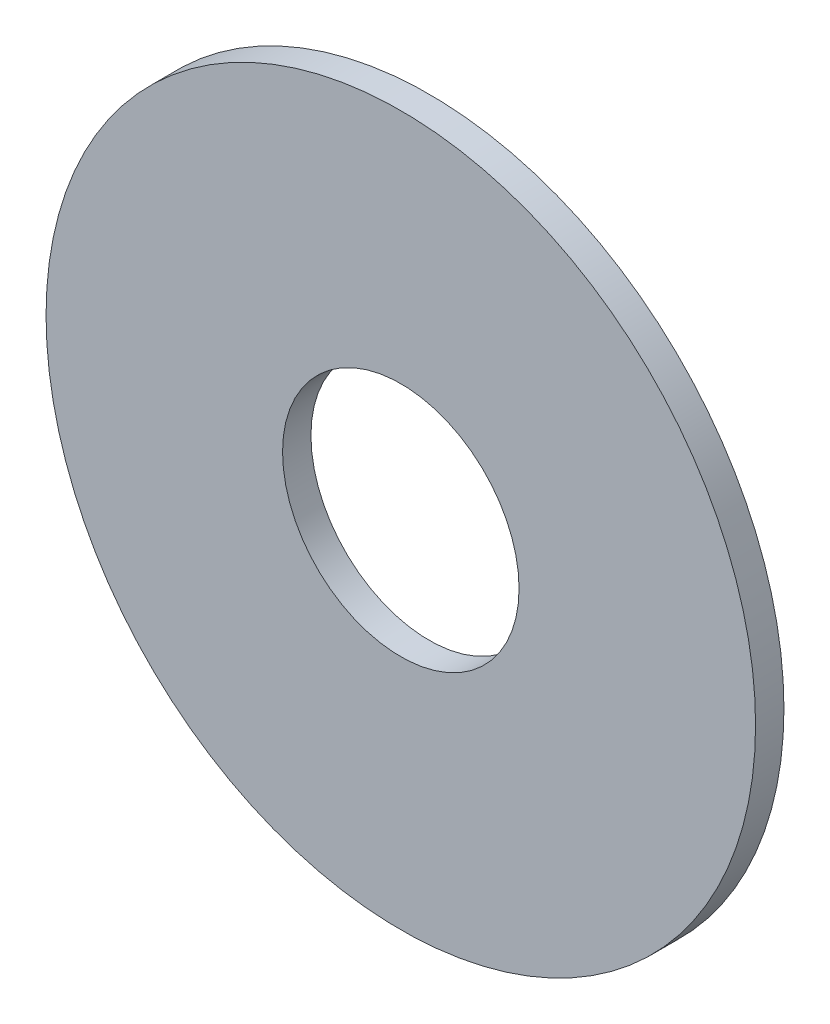
from build123d import *

# Parameters (mm, degrees)
SKETCH1_R           = 7.5
SKETCH1_R_2         = 2.5
BOSS_EXTRUDE1_DEPTH = 0.6


with BuildPart() as part:
    # Sketch1 → Boss-Extrude1 (new body)
    with BuildSketch(Plane.XY):
        Circle(SKETCH1_R)
        Circle(SKETCH1_R_2, mode=Mode.SUBTRACT)
    extrude(amount=BOSS_EXTRUDE1_DEPTH)


solid = part.part
